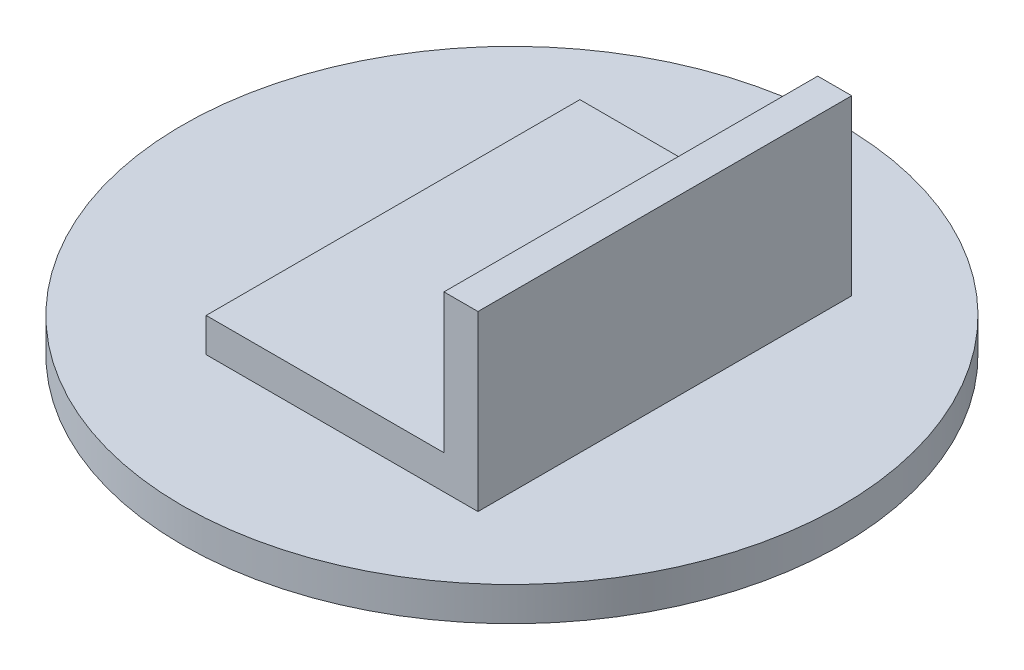
from build123d import *

# Parameters (mm, degrees)
SKETCH2_R           = 48.5
BOSS_EXTRUDE1_DEPTH = 5
SKETCH6_W           = 35
SKETCH6_H           = 55
BOSS_EXTRUDE2_DEPTH = 5
SKETCH4_R           = 1.5
CUT_EXTRUDE2_DEPTH  = 70.314500647
SKETCH5_R           = 3.75
CUT_EXTRUDE3_DEPTH  = 1.5
SKETCH7_W           = 5
SKETCH7_H           = 55
BOSS_EXTRUDE3_DEPTH = 25.5


with BuildPart() as part:
    # Sketch2 → Boss-Extrude1 (new body)
    with BuildSketch(Plane(origin=(0, 0, 0), x_dir=(1, 0, 0), z_dir=(0, 1, 0))):
        with Locations(Location((0, 0, 0), (0, 0, 270))):
            Circle(SKETCH2_R)
    extrude(amount=BOSS_EXTRUDE1_DEPTH)

    # Sketch6 → Boss-Extrude2 (add)
    with BuildSketch(Plane(origin=(0, 5, 0), x_dir=(1, 0, 0), z_dir=(0, 1, 0))):
        Rectangle(SKETCH6_W, SKETCH6_H)
    extrude(amount=BOSS_EXTRUDE2_DEPTH)

    # Sketch4 → Cut-Extrude2 (cut, through all)
    with BuildSketch(Plane.XZ):
        with Locations(Location((0, 7.25, 0), (0, 0, 270))):
            Circle(SKETCH4_R)
        with Locations(Location((0, -7.25, 0), (0, 0, 270))):
            Circle(SKETCH4_R)
    extrude(amount=-CUT_EXTRUDE2_DEPTH, mode=Mode.SUBTRACT)

    # Sketch5 → Cut-Extrude3 (cut)
    with BuildSketch(Plane.XZ):
        with Locations(Location((0, 0, 0), (0, 0, 270))):
            Circle(SKETCH5_R)
    extrude(amount=-CUT_EXTRUDE3_DEPTH, mode=Mode.SUBTRACT)

    # Sketch7 → Boss-Extrude3 (add)
    with BuildSketch(Plane(origin=(0, 5, 0), x_dir=(1, 0, 0), z_dir=(0, 1, 0))):
        with Locations((20, 0)):
            Rectangle(SKETCH7_W, SKETCH7_H)
    extrude(amount=BOSS_EXTRUDE3_DEPTH)


solid = part.part
